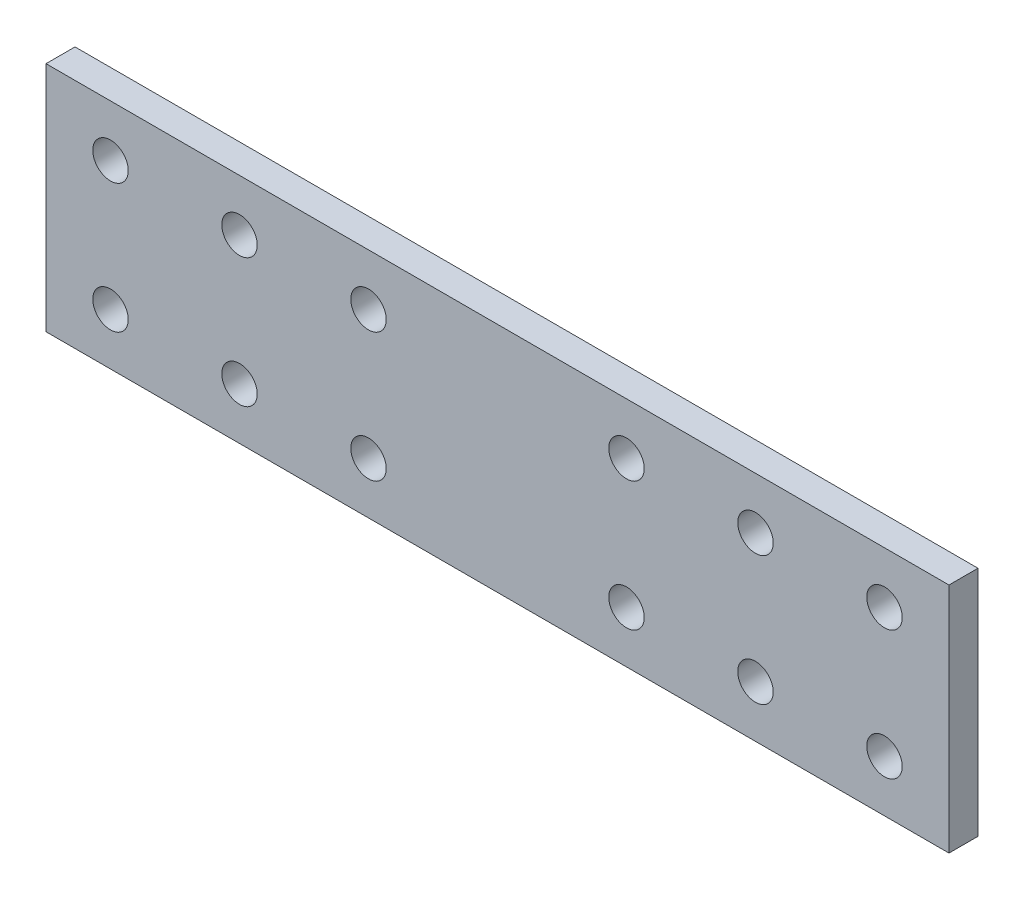
from build123d import *

# Parameters (mm, degrees)
SKETCH_1_W                       = 560
SKETCH_1_H                       = 144
EXTRUDE_7_DEPTH                  = 18
SKETCH_2_R                       = 11
CUT_EXTRUDE_2_DEPTH              = 579.498055312
PATTERN_LINEAR_2_COUNT           = 2
PATTERN_LINEAR_2_PITCH           = 80
PATTERN_LINEAR_2_COUNT_DIR2      = 3
PATTERN_LINEAR_2_PITCH_DIR2      = 80
PATTERN_LINEAR_4_COUNT           = 2
PATTERN_LINEAR_4_PITCH           = 320
PATTERN_LINEAR_4_COPY_1_SKETCH_R = 11
PATTERN_LINEAR_4_COPY_1_DEPTH    = 579.498055312
PATTERN_LINEAR_4_COPY_2_SKETCH_R = 11
PATTERN_LINEAR_4_COPY_2_DEPTH    = 579.498055312
PATTERN_LINEAR_4_COPY_3_SKETCH_R = 11
PATTERN_LINEAR_4_COPY_3_DEPTH    = 579.498055312
PATTERN_LINEAR_4_COPY_4_SKETCH_R = 11
PATTERN_LINEAR_4_COPY_4_DEPTH    = 579.498055312
PATTERN_LINEAR_4_COPY_5_SKETCH_R = 11
PATTERN_LINEAR_4_COPY_5_DEPTH    = 579.498055312


with BuildPart() as part:
    # 草图1 → 拉伸7 (new body)
    with BuildSketch(Plane.XY):
        with Locations((280, 72)):
            Rectangle(SKETCH_1_W, SKETCH_1_H)
    extrude(amount=EXTRUDE_7_DEPTH)

    # 草图2 → 切除-拉伸2 (cut, through all)
    with BuildSketch(Plane.XY.offset(18)):
        with Locations((40, 112)):
            Circle(SKETCH_2_R)
    cut_extrude_2 = extrude(amount=-CUT_EXTRUDE_2_DEPTH, mode=Mode.SUBTRACT)

    # 阵列(线性)2: Cut-Extrude 2 2 × 3
    with Locations(*[(j * PATTERN_LINEAR_2_PITCH_DIR2, -i * PATTERN_LINEAR_2_PITCH, 0) for i in range(PATTERN_LINEAR_2_COUNT) for j in range(PATTERN_LINEAR_2_COUNT_DIR2) if (i, j) != (0, 0)]):
        add(cut_extrude_2, mode=Mode.SUBTRACT)

    # 阵列(线性)4: 切除-拉伸2 ×2
    with Locations(*[(i * PATTERN_LINEAR_4_PITCH, 0, 0) for i in range(1, PATTERN_LINEAR_4_COUNT)]):
        add(cut_extrude_2, mode=Mode.SUBTRACT)

    # 阵列(线性)4 copy 1 sketch → 阵列(线性)4 copy 1 (cut, through all)
    with BuildSketch(Plane(origin=(400, 0, 18), x_dir=(1, 0, 0), z_dir=(0, 0, 1))):
        with Locations((40, 112)):
            Circle(PATTERN_LINEAR_4_COPY_1_SKETCH_R)
    extrude(amount=-PATTERN_LINEAR_4_COPY_1_DEPTH, mode=Mode.SUBTRACT)

    # 阵列(线性)4 copy 2 sketch → 阵列(线性)4 copy 2 (cut, through all)
    with BuildSketch(Plane(origin=(480, 0, 18), x_dir=(1, 0, 0), z_dir=(0, 0, 1))):
        with Locations((40, 112)):
            Circle(PATTERN_LINEAR_4_COPY_2_SKETCH_R)
    extrude(amount=-PATTERN_LINEAR_4_COPY_2_DEPTH, mode=Mode.SUBTRACT)

    # 阵列(线性)4 copy 3 sketch → 阵列(线性)4 copy 3 (cut, through all)
    with BuildSketch(Plane(origin=(320, -80, 18), x_dir=(1, 0, 0), z_dir=(0, 0, 1))):
        with Locations((40, 112)):
            Circle(PATTERN_LINEAR_4_COPY_3_SKETCH_R)
    extrude(amount=-PATTERN_LINEAR_4_COPY_3_DEPTH, mode=Mode.SUBTRACT)

    # 阵列(线性)4 copy 4 sketch → 阵列(线性)4 copy 4 (cut, through all)
    with BuildSketch(Plane(origin=(400, -80, 18), x_dir=(1, 0, 0), z_dir=(0, 0, 1))):
        with Locations((40, 112)):
            Circle(PATTERN_LINEAR_4_COPY_4_SKETCH_R)
    extrude(amount=-PATTERN_LINEAR_4_COPY_4_DEPTH, mode=Mode.SUBTRACT)

    # 阵列(线性)4 copy 5 sketch → 阵列(线性)4 copy 5 (cut, through all)
    with BuildSketch(Plane(origin=(480, -80, 18), x_dir=(1, 0, 0), z_dir=(0, 0, 1))):
        with Locations((40, 112)):
            Circle(PATTERN_LINEAR_4_COPY_5_SKETCH_R)
    extrude(amount=-PATTERN_LINEAR_4_COPY_5_DEPTH, mode=Mode.SUBTRACT)


solid = part.part
